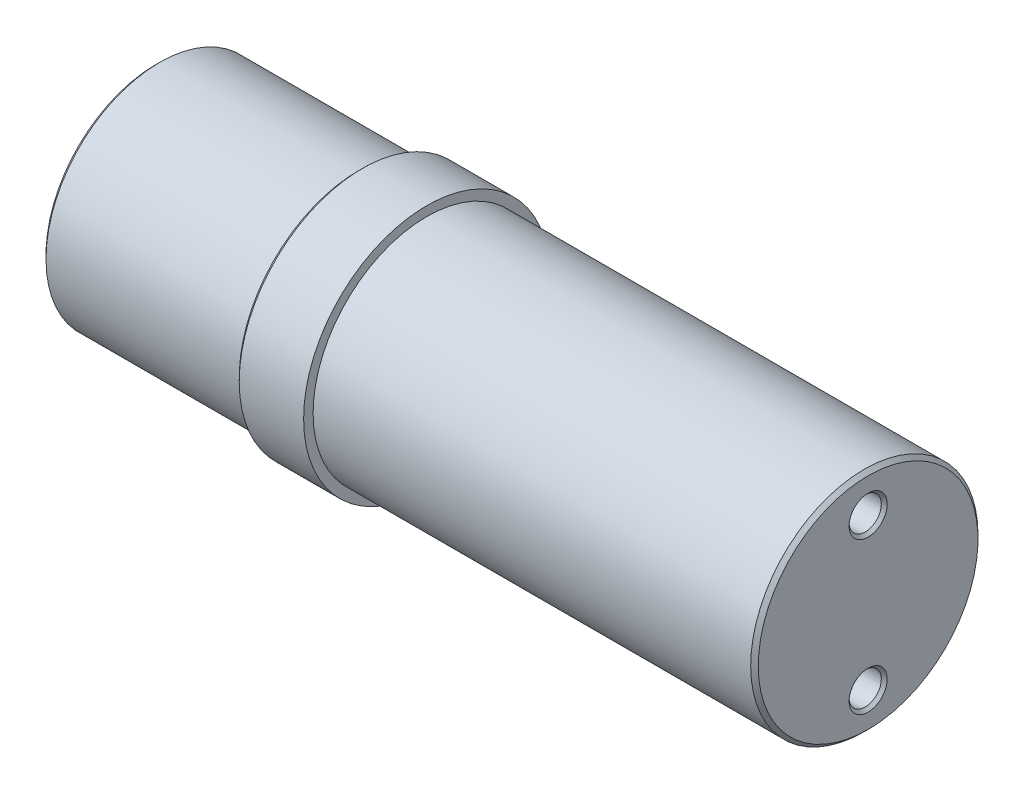
from build123d import *

# Parameters (mm, degrees)
M10_TAPPED_HOLE1_D           = 8.5
M10_TAPPED_HOLE1_DEPTH       = 24.5
M10_TAPPED_HOLE1_CSINK_D     = 10.05
M10_TAPPED_HOLE1_CSINK_ANGLE = 90
M10_TAPPED_HOLE1_TIP         = 2.553657631
M10_TAPPED_HOLE2_D           = 8.5
M10_TAPPED_HOLE2_DEPTH       = 24.5
M10_TAPPED_HOLE2_CSINK_D     = 10.05
M10_TAPPED_HOLE2_CSINK_ANGLE = 90
M10_TAPPED_HOLE2_TIP         = 2.553657631
CHAMFER1_SIZE                = 1


with BuildPart() as part:
    # Sketch1 → Revolve1 (revolve)
    with BuildSketch(Plane.XY, mode=Mode.PRIVATE) as revolve1_sk:
        Polygon((0, 0), (0, 30), (53.5, 30), (53.5, 32.5), (71.5, 32.5), (71.5, 30), (188, 30), (188, 0), align=None)
    revolve(revolve1_sk.sketch.rotate(Axis((0, 0, 0), (1, 0, 0)), 90), axis=Axis((0, 0, 0), (1, 0, 0)))

    # M10 Tapped Hole1
    with Locations(Plane(origin=(0, 20, 0), x_dir=(0, 0, -1), z_dir=(-1, 0, 0))):
        with Locations((0, 0), (0, 40)):
            CounterSinkHole(M10_TAPPED_HOLE1_D / 2, M10_TAPPED_HOLE1_CSINK_D / 2, depth=M10_TAPPED_HOLE1_DEPTH, counter_sink_angle=M10_TAPPED_HOLE1_CSINK_ANGLE)
            with Locations((0, 0, -(M10_TAPPED_HOLE1_DEPTH + M10_TAPPED_HOLE1_TIP / 2))):  # 118° drill point
                Cone(0, M10_TAPPED_HOLE1_D / 2, M10_TAPPED_HOLE1_TIP, mode=Mode.SUBTRACT)

    # M10 Tapped Hole2
    with Locations(Plane(origin=(188, 20, 0), x_dir=(0, 0, 1), z_dir=(1, 0, 0))):
        with Locations((0, 0), (0, 40)):
            CounterSinkHole(M10_TAPPED_HOLE2_D / 2, M10_TAPPED_HOLE2_CSINK_D / 2, depth=M10_TAPPED_HOLE2_DEPTH, counter_sink_angle=M10_TAPPED_HOLE2_CSINK_ANGLE)
            with Locations((0, 0, -(M10_TAPPED_HOLE2_DEPTH + M10_TAPPED_HOLE2_TIP / 2))):  # 118° drill point
                Cone(0, M10_TAPPED_HOLE2_D / 2, M10_TAPPED_HOLE2_TIP, mode=Mode.SUBTRACT)

    # Chamfer1
    chamfer1_edges = [part.edges().sort_by_distance(p)[0] for p in [
        (0, 0, -30),
        (53.5, 0, -32.5),
        (188, 0, -30),
    ]]
    chamfer(chamfer1_edges, length=CHAMFER1_SIZE)


solid = part.part
